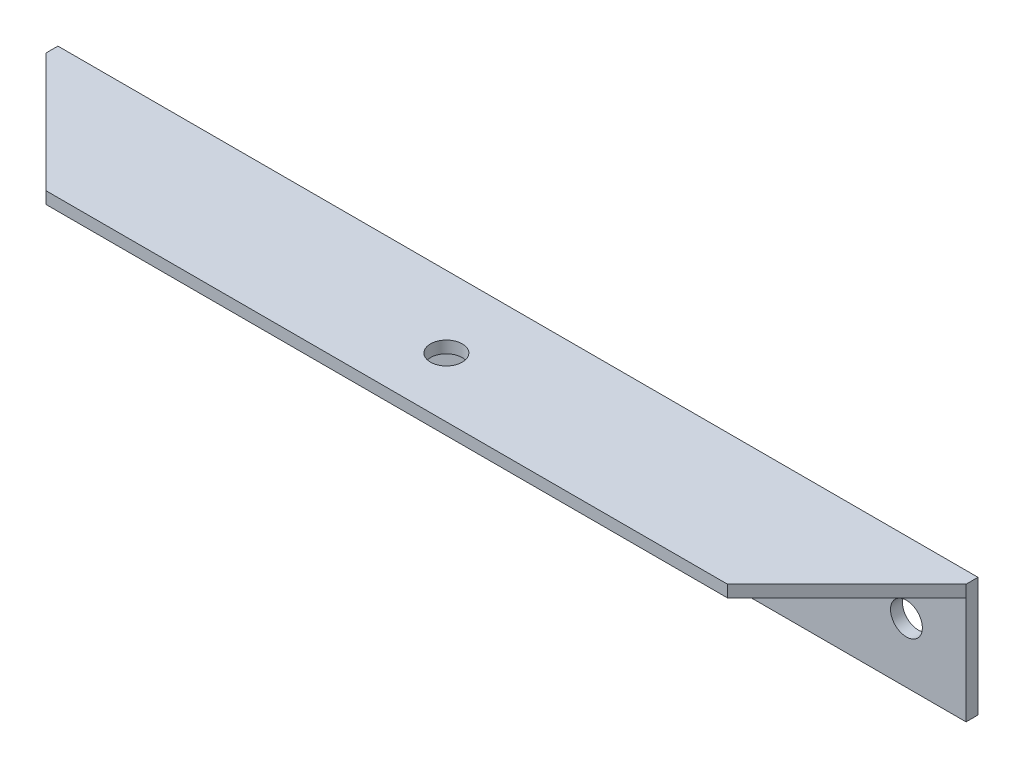
from build123d import *

# Parameters (mm, degrees)
SKETCH1_W                  = 231.4
SKETCH1_H                  = 30
BOSS_EXTRUDE1_DEPTH        = 3
BOSS_EXTRUDE2_DEPTH        = 3
F_8_0_8_DIAMETER_HOLE1_D   = 8
F_8_0_8_DIAMETER_HOLE2_D   = 8
F_10_0_10_DIAMETER_HOLE1_D = 10


with BuildPart() as part:
    # Sketch1 → Boss-Extrude1 (new body)
    with BuildSketch(Plane.XY):
        with Locations((0, -15)):
            Rectangle(SKETCH1_W, SKETCH1_H)
    extrude(amount=BOSS_EXTRUDE1_DEPTH)

    # Sketch2 → Boss-Extrude2 (add)
    with BuildSketch(Plane(origin=(0, 0, 0), x_dir=(1, 0, 0), z_dir=(0, 1, 0))):
        Polygon((-115.7, -3), (115.7, -3), (85.7, -33), (-85.7, -33), align=None)
    extrude(amount=-BOSS_EXTRUDE2_DEPTH)

    # Ø8.0 (8) Diameter Hole1 (through all)
    with Locations(Plane.XY.offset(3)):
        with Locations((-100.7, -15), (100.7, -15)):
            Hole(F_8_0_8_DIAMETER_HOLE1_D / 2)

    # Ø8.0 (8) Diameter Hole2 (through all)
    with Locations(Plane(origin=(0, 0, 0), x_dir=(1, 0, 0), z_dir=(0, 1, 0))):
        with Locations((0, -18)):
            Hole(F_8_0_8_DIAMETER_HOLE2_D / 2)

    # Ø10.0 (10) Diameter Hole1 (through all)
    with Locations(Plane.XY.offset(3)):
        with Locations((62.5, -15)):
            Hole(F_10_0_10_DIAMETER_HOLE1_D / 2)


solid = part.part
